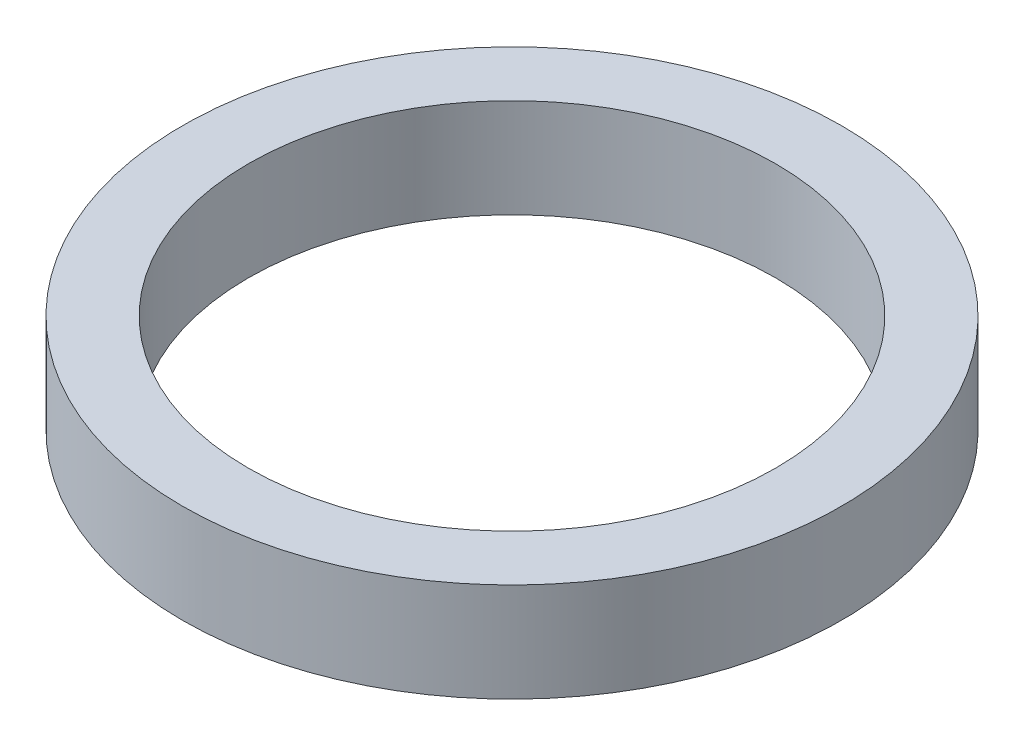
from build123d import *

# Parameters (mm, degrees)
SKETCH2_R           = 5
SKETCH2_R_2         = 4
BOSS_EXTRUDE1_DEPTH = 1.5


with BuildPart() as part:
    # Sketch2 → Boss-Extrude1 (new body)
    with BuildSketch(Plane(origin=(0, 0, 0), x_dir=(1, 0, 0), z_dir=(0, 1, 0))):
        with Locations(Location((0, 0, 0), (0, 0, 270))):
            Circle(SKETCH2_R)
        with Locations(Location((0, 0, 0), (0, 0, 270))):
            Circle(SKETCH2_R_2, mode=Mode.SUBTRACT)
    extrude(amount=BOSS_EXTRUDE1_DEPTH)


solid = part.part
